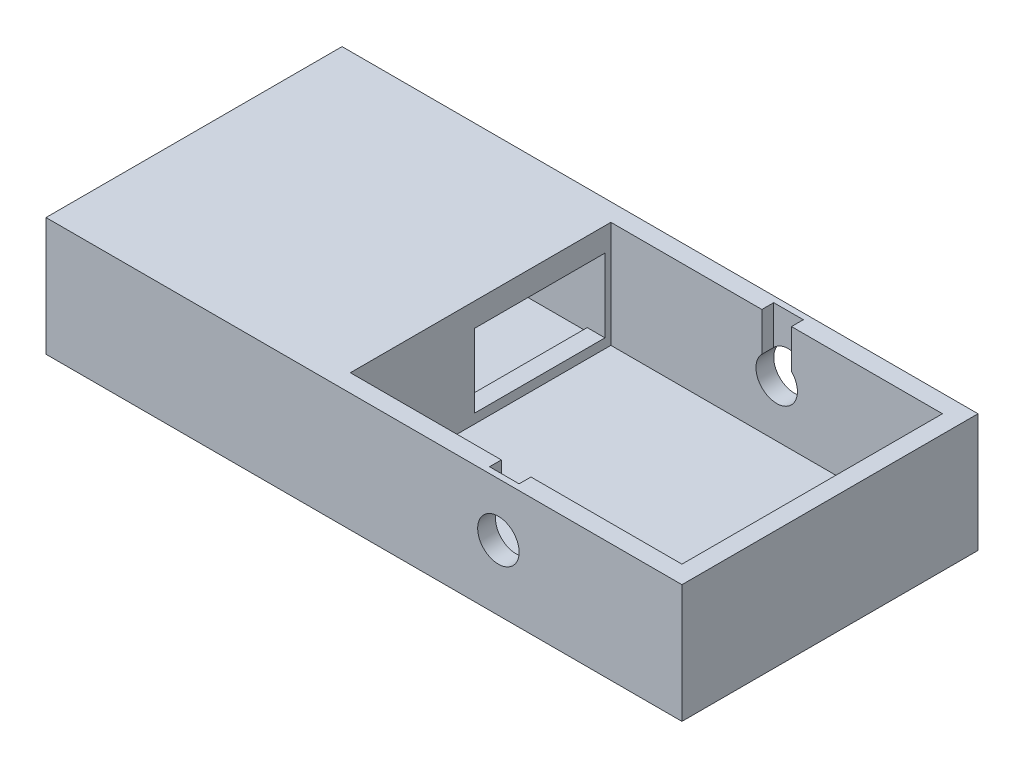
from build123d import *

# Parameters (mm, degrees)
SKETCH1_W                = 71.12
SKETCH1_H                = 55.88
PCB_BASE_DEPTH           = 2.54
SKETCH1_4_W              = 78.74
SKETCH1_4_H              = 63.5
SKETCH1_4_W_2            = 71.12
SKETCH1_4_H_2            = 55.88
PCB_WALL_DEPTH           = 25.4
SKETCH2_W                = 27.94
SKETCH2_H                = 15.748
PCB_GAP_DEPTH            = 3.81
LID_HOLE_1_DEPTH         = 3.81
HOLE_SLIDE_1_DEPTH       = 2.54
LID_HOLE_2_START         = -3.81
LID_HOLE_2_DEPTH         = 3.81
HOLE_SLIDE_2_START       = -2.54
HOLE_SLIDE_2_DEPTH       = 2.54
SKETCH5_W                = 27.94
SKETCH5_H                = 5.08
BOSS_EXTRUDE3_DEPTH      = 48.768
BOSS_EXTRUDE4_DEPTH      = 8.89
BOSS_EXTRUDE4_DEPTH_BACK = 1.27
SKETCH7_W                = 38.1
SKETCH7_H                = 25.4
BOSS_EXTRUDE5_DEPTH      = 25.4
SKETCH9_W                = 57.658
SKETCH9_H                = 25.4
BOSS_EXTRUDE6_DEPTH      = 3.81


with BuildPart() as part:
    # Sketch1 → pcb-base (new body)
    with BuildSketch(Plane(origin=(0, 0, 0), x_dir=(1, 0, 0), z_dir=(0, 1, 0))):
        Rectangle(SKETCH1_W, SKETCH1_H)
    extrude(amount=PCB_BASE_DEPTH)

    # Sketch1<4> → pcb-wall (add)
    with BuildSketch(Plane(origin=(0, 0, 0), x_dir=(1, 0, 0), z_dir=(0, 1, 0))):
        Rectangle(SKETCH1_4_W, SKETCH1_4_H)
        Rectangle(SKETCH1_4_W_2, SKETCH1_4_H_2, mode=Mode.SUBTRACT)
    extrude(amount=PCB_WALL_DEPTH)

    # Sketch2 → pcb-gap (cut)
    with BuildSketch(Plane.ZY.offset(39.37)):
        with Locations((-12.7, 12.446)):
            Rectangle(SKETCH2_W, SKETCH2_H)
    extrude(amount=-PCB_GAP_DEPTH, mode=Mode.SUBTRACT)

    # Sketch4 → lid-hole-1 (cut)
    with BuildSketch(Plane(origin=(0, 0, 27.94), x_dir=(-1, 0, 0), z_dir=(0, 0, -1))):
        with BuildLine():
            ThreePointArc((3.175, 17.080851973), (0, 18.415), (-3.175, 17.080851973))
            Line((-3.175, 17.080851973), (-3.175, 13.97))
            Line((-3.175, 13.97), (3.175, 13.97))
            Line((3.175, 13.97), (3.175, 17.080851973))
        make_face()
        with BuildLine():
            Line((-3.175, 13.97), (-3.175, 17.080851973))
            ThreePointArc((-3.175, 17.080851973), (-1.680052083, 9.854729657), (4.445, 13.97))
            ThreePointArc((4.445, 13.97), (4.115270343, 15.650052083), (3.175, 17.080851973))
            Line((3.175, 17.080851973), (3.175, 13.97))
            Line((3.175, 13.97), (-3.175, 13.97))
        make_face()
    extrude(amount=-LID_HOLE_1_DEPTH, mode=Mode.SUBTRACT)

    # Sketch4<6> → hole-slide-1 (cut)
    with BuildSketch(Plane(origin=(0, 0, 27.94), x_dir=(-1, 0, 0), z_dir=(0, 0, -1))):
        with BuildLine():
            Line((3.175, 25.4), (-3.175, 25.4))
            Line((-3.175, 25.4), (-3.175, 17.080851973))
            ThreePointArc((-3.175, 17.080851973), (0, 18.415), (3.175, 17.080851973))
            Line((3.175, 17.080851973), (3.175, 25.4))
        make_face()
    extrude(amount=-HOLE_SLIDE_1_DEPTH, mode=Mode.SUBTRACT)

    # Sketch3 → lid-hole-2 (cut)
    with BuildSketch(Plane.XY.offset(-27.94).offset(LID_HOLE_2_START)):
        with BuildLine():
            Line((-3.175, 17.080851973), (-3.175, 13.97))
            Line((-3.175, 13.97), (3.175, 13.97))
            Line((3.175, 13.97), (3.175, 17.080851973))
            ThreePointArc((3.175, 17.080851973), (0, 18.415), (-3.175, 17.080851973))
        make_face()
        with BuildLine():
            Line((3.175, 13.97), (-3.175, 13.97))
            Line((-3.175, 13.97), (-3.175, 17.080851973))
            ThreePointArc((-3.175, 17.080851973), (-1.680052083, 9.854729657), (4.445, 13.97))
            ThreePointArc((4.445, 13.97), (4.115270343, 15.650052083), (3.175, 17.080851973))
            Line((3.175, 17.080851973), (3.175, 13.97))
        make_face()
    extrude(amount=LID_HOLE_2_DEPTH, mode=Mode.SUBTRACT)

    # Sketch3<5> → hole-slide-2 (cut)
    with BuildSketch(Plane.XY.offset(-27.94).offset(HOLE_SLIDE_2_START)):
        with BuildLine():
            Line((-3.175, 25.4), (-3.175, 17.080851973))
            ThreePointArc((-3.175, 17.080851973), (0, 18.415), (3.175, 17.080851973))
            Line((3.175, 17.080851973), (3.175, 25.4))
            Line((3.175, 25.4), (-3.175, 25.4))
        make_face()
    extrude(amount=HOLE_SLIDE_2_DEPTH, mode=Mode.SUBTRACT)

    # Sketch5 → Boss-Extrude3 (add)
    with BuildSketch(Plane.ZY.offset(39.37)):
        Polygon((-31.75, 25.4), (-31.75, 3.81), (-26.67, 3.81), (-26.67, 4.572), (-26.67, 20.32), (-26.67, 25.4), align=None)
        with Locations((-12.7, 22.86)):
            Rectangle(SKETCH5_W, SKETCH5_H)
        Polygon((1.27, 3.81), (6.35, 3.81), (6.35, 25.4), (1.27, 25.4), (1.27, 20.32), (1.27, 4.572), align=None)
        Polygon((-31.75, 3.81), (-31.75, 0), (6.35, 0), (6.35, 3.81), (1.27, 3.81), (-26.67, 3.81), align=None)
    extrude(amount=BOSS_EXTRUDE3_DEPTH)

    # Sketch7 → Boss-Extrude4 (add, two sides: drawn at the far end of the back side and taken through both)
    with BuildSketch(Plane.ZY.offset(88.138).offset(-BOSS_EXTRUDE4_DEPTH_BACK)):
        with Locations((-12.7, 12.7)):
            Rectangle(SKETCH7_W, SKETCH7_H)
    extrude(amount=BOSS_EXTRUDE4_DEPTH + BOSS_EXTRUDE4_DEPTH_BACK)

    # Sketch8 → Boss-Extrude5 (add)
    with BuildSketch(Plane.XY.offset(6.35)):
        Polygon((-97.028, 25.4), (-97.028, 0), (-39.37, 0), (-39.37, 2.54), (-94.488, 2.54), (-94.488, 22.86), (-39.37, 22.86), (-39.37, 25.4), align=None)
    extrude(amount=BOSS_EXTRUDE5_DEPTH)

    # Sketch9 → Boss-Extrude6 (add)
    with BuildSketch(Plane.XY.offset(31.75)):
        with Locations((-68.199, 12.7)):
            Rectangle(SKETCH9_W, SKETCH9_H)
    extrude(amount=-BOSS_EXTRUDE6_DEPTH)


solid = part.part
